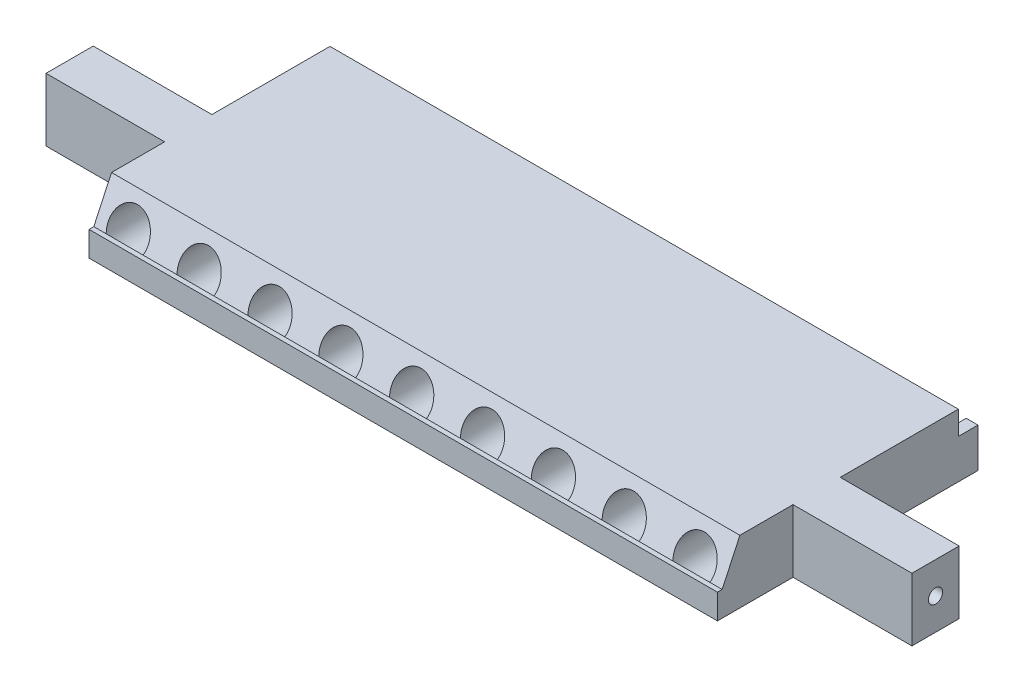
from build123d import *

# Parameters (mm, degrees)
SKETCH_1_W          = 220
SKETCH_1_H          = 16
SKETCH_1_R          = 5.1
EXTRUDE_1_DEPTH     = 65
SKETCH_2_W          = 220
SKETCH_2_H          = 5
CUT_EXTRUDE_1_DEPTH = 6
SKETCH_3_W          = 30.147927972
SKETCH_3_H          = 35
SKETCH_3_H_2        = 18
SKETCH_3_W_2        = 30.207927972
CUT_EXTRUDE_2_DEPTH = 230.958691943
SKETCH_4_R          = 1.8
CUT_EXTRUDE_3_DEPTH = 10
CUT_EXTRUDE_START   = -10
SKETCH_5_R          = 1.8
CUT_EXTRUDE_4_DEPTH = 10
CUT_EXTRUDE_7_DEPTH = 202.251162989
SKETCH_9_W          = 159.644144056
SKETCH_9_H          = 6.33180748
EXTRUDE_2_DEPTH     = 1.2


with BuildPart() as part:
    # Эскиз1 → Бобышка-Вытянуть1 (new body)
    with BuildSketch(Plane.XY):
        with Locations((110, 8)):
            Rectangle(SKETCH_1_W, SKETCH_1_H)
        with Locations((37.97, 8.339391268)):
            Circle(SKETCH_1_R, mode=Mode.SUBTRACT)
        with Locations((55.97, 8.339391268)):
            Circle(SKETCH_1_R, mode=Mode.SUBTRACT)
        with Locations((73.97, 8.339391268)):
            Circle(SKETCH_1_R, mode=Mode.SUBTRACT)
        with Locations((91.97, 8.339391268)):
            Circle(SKETCH_1_R, mode=Mode.SUBTRACT)
        with Locations((109.97, 8.339391268)):
            Circle(SKETCH_1_R, mode=Mode.SUBTRACT)
        with Locations((127.97, 8.339391268)):
            Circle(SKETCH_1_R, mode=Mode.SUBTRACT)
        with Locations((145.97, 8.339391268)):
            Circle(SKETCH_1_R, mode=Mode.SUBTRACT)
        with Locations((163.97, 8.339391268)):
            Circle(SKETCH_1_R, mode=Mode.SUBTRACT)
        with Locations((181.97, 8.339391268)):
            Circle(SKETCH_1_R, mode=Mode.SUBTRACT)
    extrude(amount=EXTRUDE_1_DEPTH)

    # Эскиз2 → Вырез-Вытянуть1 (cut)
    with BuildSketch(Plane(origin=(0, 16, 0), x_dir=(1, 0, 0), z_dir=(0, 1, 0))):
        with Locations((110, -2.5)):
            Rectangle(SKETCH_2_W, SKETCH_2_H)
    extrude(amount=-CUT_EXTRUDE_1_DEPTH, mode=Mode.SUBTRACT)

    # Эскиз3 → Вырез-Вытянуть2 (cut, through all)
    with BuildSketch(Plane(origin=(0, 16, 0), x_dir=(1, 0, 0), z_dir=(0, 1, 0))):
        with Locations((15.073963986, -17.5)):
            Rectangle(SKETCH_3_W, SKETCH_3_H)
        with Locations((15.073963986, -56)):
            Rectangle(SKETCH_3_W, SKETCH_3_H_2)
        with Locations((204.896036014, -17.5)):
            Rectangle(SKETCH_3_W_2, SKETCH_3_H)
        with Locations((204.896036014, -56)):
            Rectangle(SKETCH_3_W_2, SKETCH_3_H_2)
    extrude(amount=-CUT_EXTRUDE_2_DEPTH, mode=Mode.SUBTRACT)

    # Эскиз4 → Вырез-Вытянуть3 (cut)
    with BuildSketch(Plane.ZY):
        with Locations((41, 8)):
            Circle(SKETCH_4_R)
    extrude(amount=-CUT_EXTRUDE_3_DEPTH, mode=Mode.SUBTRACT)

    # Эскиз5 → Вырез-Вытянуть4 (cut)
    with BuildSketch(Plane(origin=(220, 0, 0), x_dir=(0, 0, -1), z_dir=(1, 0, 0)).offset(CUT_EXTRUDE_START)):
        with Locations(Location((-41, 8, 0), (0, 0, 180))):
            Circle(SKETCH_5_R)
    extrude(amount=CUT_EXTRUDE_4_DEPTH, mode=Mode.SUBTRACT)

    # Эскиз8 → Вырез-Вытянуть7 (cut, through all)
    with BuildSketch(Plane(origin=(189.792072028, 0, 0), x_dir=(0, 0, -1), z_dir=(1, 0, 0))):
        Polygon((-65, 6.33180748), (-60.500350176, 16), (-65, 16), align=None)
    extrude(amount=-CUT_EXTRUDE_7_DEPTH, mode=Mode.SUBTRACT)

    # Эскиз9 → Бобышка-Вытянуть2 (add)
    with BuildSketch(Plane.XY.offset(65)):
        with Locations((109.97, 3.16590374)):
            Rectangle(SKETCH_9_W, SKETCH_9_H)
    extrude(amount=EXTRUDE_2_DEPTH)


solid = part.part
